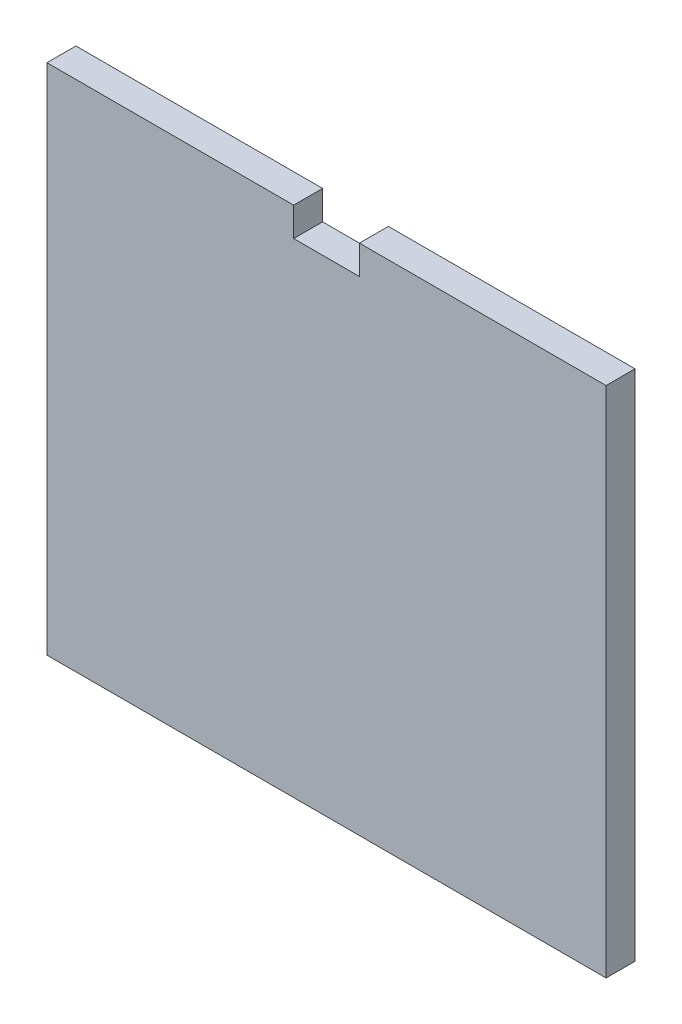
from build123d import *

# Parameters (mm, degrees)
BOSS_EXTRUDE1_DEPTH = 2.794


with BuildPart() as part:
    # Sketch1 → Boss-Extrude1 (new, symmetric)
    with BuildSketch(Plane.XY):
        Polygon((-6.35, 49.53), (-6.35, 43.942), (6.35, 43.942), (6.35, 49.53), (53.975, 49.53), (53.975, -49.53), (-53.975, -49.53), (-53.975, 49.53), align=None)
    extrude(amount=BOSS_EXTRUDE1_DEPTH, both=True)


solid = part.part
